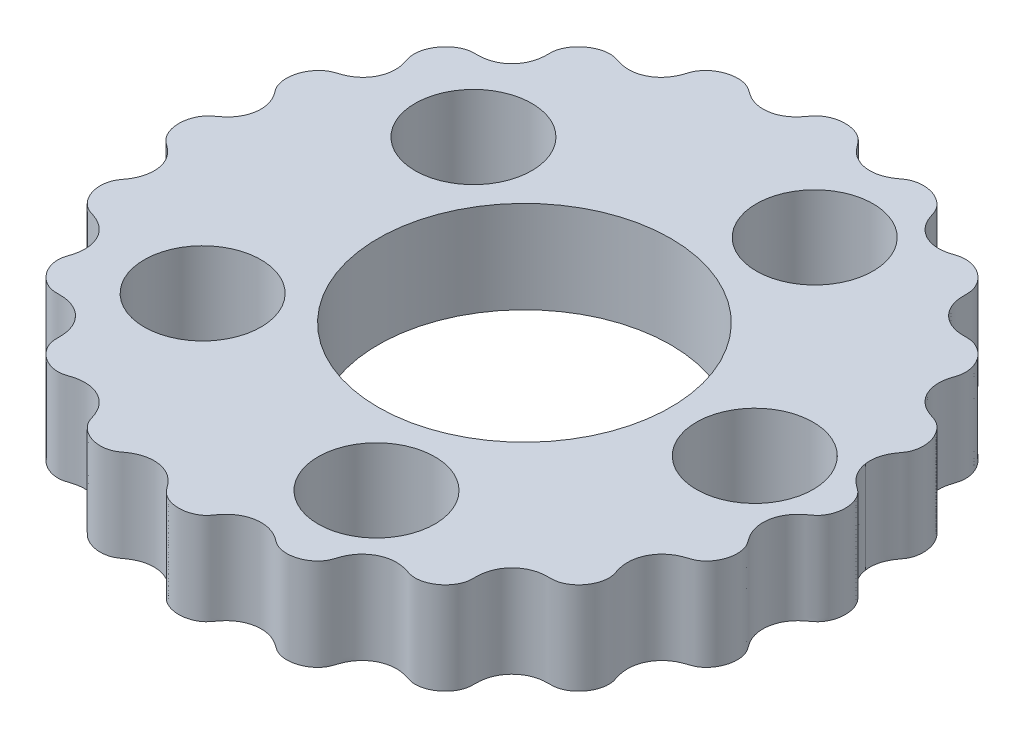
from build123d import *

# Parameters (mm, degrees)
BOSS_EXTRUDE1_START = -1
MAIN_R              = 3.8
MAIN_R_2            = 9.525
BOSS_EXTRUDE1_DEPTH = 6


with BuildPart() as part:
    # MAIN → Boss-Extrude1 (new body)
    with BuildSketch(Plane(origin=(0, 0, 0), x_dir=(1, 0, 0), z_dir=(0, 1, 0)).offset(BOSS_EXTRUDE1_START)):
        with BuildLine():
            add(Edge.make_bspline(
                [(18.252535646, 3.144332747), (18.255931863, 3.122889875), (18.263462541, 3.080075817), (18.279163711, 3.002239377), (18.304264572, 2.900482494), (18.339834412, 2.782038073), (18.390751128, 2.643851255), (18.462636991, 2.484148254), (18.560104298, 2.311641287), (18.672408802, 2.147422449), (18.798228766, 1.993760992), (18.928540075, 1.858883437), (19.059768447, 1.741229888), (19.18873713, 1.638248266), (19.312723639, 1.547238588), (19.437526543, 1.457275247), (19.556609306, 1.35961506), (19.69122381, 1.221787051), (19.85447467, 0.999181145), (20.009441583, 0.673834661), (20.108023531, 0.248073332), (20.109312267, -0.225630706), (20.019147328, -0.635900026), (19.870873584, -0.969925757), (19.689337954, -1.231588239), (19.4944149, -1.421956288), (19.232139459, -1.600600495), (18.947282346, -1.826873991), (18.666926986, -2.129192649), (18.427264596, -2.520635554), (18.271742356, -2.951520203), (18.207615735, -3.403953042), (18.232804752, -3.802125866), (18.310704036, -4.133040174), (18.410591455, -4.397520078), (18.510084776, -4.600453812), (18.631435503, -4.801962603), (18.773031091, -5.000094029), (18.92489094, -5.202962811), (19.039495675, -5.440256941), (19.124128639, -5.738860614), (19.156687742, -6.096281675), (19.113610345, -6.503154294), (18.969385924, -6.93878417), (18.7551245, -7.299557613), (18.523760571, -7.552287386), (18.31489617, -7.712230615), (18.155093135, -7.804449902), (18.020167141, -7.864119464), (17.880713505, -7.911905257), (17.740376268, -7.956724154), (17.532715263, -8.029164247), (17.26395948, -8.146164513), (16.950583676, -8.337718106), (16.625052145, -8.63456365), (16.362055861, -8.991263367), (16.173610007, -9.395412349), (16.068928435, -9.831425328), (16.054349968, -10.225840714), (16.095995363, -10.560219716), (16.163730779, -10.841530538), (16.238233233, -11.071240792), (16.317003389, -11.309867227), (16.348562097, -11.569200033), (16.334127584, -11.876452864), (16.252818366, -12.222925508), (16.082801815, -12.599328222), (15.801555578, -12.975928494), (15.466119616, -13.261772977), (15.139288714, -13.433369321), (14.86359615, -13.514482765), (14.658923302, -13.541247597), (14.494064481, -13.544802883), (14.288163432, -13.543201012), (14.023933266, -13.552909377), (13.703645899, -13.599468125), (13.33829345, -13.713279132), (12.983032231, -13.897034556), (12.664869655, -14.141906152), (12.39479947, -14.44104443), (12.182254841, -14.785197113), (12.034064654, -15.163092392), (11.959620001, -15.531589393), (11.94192056, -15.840622458), (11.945526732, -16.084119035), (11.939080047, -16.298126116), (11.905095877, -16.510234861), (11.810276268, -16.791969612), (11.620030062, -17.12079808), (11.337038761, -17.436072965), (10.957496979, -17.707126628), (10.569148027, -17.872208849), (10.23558904, -17.938959934), (9.974518235, -17.944810716), (9.792533987, -17.925257271), (9.649486971, -17.894297022), (9.509700321, -17.851322129), (9.370923441, -17.805476345), (9.156619674, -17.740791575), (8.86150303, -17.675846371), (8.480819172, -17.648062059), (8.024404129, -17.706199311), (7.592432005, -17.855014485), (7.202560292, -18.086629025), (6.869637911, -18.389375748), (6.637372893, -18.703596471), (6.483412698, -18.999772342), (6.39158475, -19.235955255), (6.33735846, -19.400830623), (6.281624507, -19.572728438), (6.212564228, -19.747873537), (6.100288446, -19.937593234), (5.908822978, -20.168241143), (5.641833206, -20.393207529), (5.289190539, -20.590573871), (4.850509795, -20.724946141), (4.427529312, -20.758735513), (4.079790406, -20.712643032), (3.822609429, -20.628686675), (3.65077244, -20.544644242), (3.521609311, -20.462833571), (3.367480227, -20.350137208), (3.152598709, -20.196380241), (2.858899765, -20.027499983), (2.47164602, -19.882802166), (2.028358751, -19.810724515), (1.584055993, -19.828070491), (1.156158823, -19.931801662), (0.760911539, -20.114778533), (0.454337154, -20.334809347), (0.224179279, -20.560336954), (0.047278491, -20.773736596), (-0.08758477, -20.962405135), (-0.231590296, -21.156579793), (-0.417590931, -21.326011751), (-0.664822067, -21.487756839), (-0.978774511, -21.621341103), (-1.359808069, -21.705013016), (-1.798800674, -21.709764698), (-2.185526583, -21.632945583), (-2.508996457, -21.50148924), (-2.762347714, -21.341299094), (-2.927765633, -21.195558235), (-3.04756269, -21.050327171), (-3.153690808, -20.904064922), (-3.256211446, -20.764016131), (-3.416529897, -20.56776917), (-3.654477933, -20.333665526), (-3.972474745, -20.106597679), (-4.382656563, -19.92154712), (-4.825019462, -19.821745581), (-5.28183576, -19.813700672), (-5.733877675, -19.899448862), (-6.087343705, -20.043511096), (-6.347947146, -20.196473712), (-6.531773445, -20.324216092), (-6.649590989, -20.410702445), (-6.769255924, -20.494770393), (-6.895734755, -20.568419454), (-7.062769094, -20.643251766), (-7.312871469, -20.718363377), (-7.650729742, -20.757953385), (-8.071088583, -20.72095942), (-8.515808623, -20.58045368), (-8.882383705, -20.368063614), (-9.164917646, -20.114110374), (-9.342181105, -19.875478838), (-9.440003359, -19.684228725), (-9.500304626, -19.51632386), (-9.543757526, -19.380469346), (-9.610124748, -19.183456927), (-9.713975801, -18.930330378), (-9.881154258, -18.634138589), (-10.138803675, -18.32049654), (-10.447330051, -18.058887495), (-10.796599078, -17.85783423), (-11.174873852, -17.723273328), (-11.56952079, -17.658287662), (-11.952168331, -17.662951074), (-12.271162516, -17.717642726), (-12.525462925, -17.790062546), (-12.720790276, -17.855212284), (-12.878679428, -17.902775435), (-13.08160551, -17.940567871), (-13.368870225, -17.94861813), (-13.732731025, -17.886416586), (-14.140080414, -17.718217757), (-14.523937348, -17.446959472), (-14.801947543, -17.141517227), (-14.986343133, -16.837128088), (-15.09501752, -16.549373793), (-15.145141647, -16.292981459), (-15.143966403, -16.041692918), (-15.144094729, -15.800202959), (-15.166604346, -15.511729074), (-15.230326015, -15.18084661), (-15.366072019, -14.810240281), (-15.60036553, -14.427915681), (-15.904477092, -14.10178013), (-16.264827695, -13.843808861), (-16.666156897, -13.662086747), (-17.023388314, -13.576746903), (-17.315145323, -13.548523142), (-17.535027894, -13.543799299), (-17.682346334, -13.544540591), (-17.829741274, -13.542187115), (-17.97650235, -13.527132497), (-18.156981567, -13.488808415), (-18.405048234, -13.401236392), (-18.703186868, -13.23237078), (-19.018445652, -12.955466384), (-19.290229869, -12.585723863), (-19.456927008, -12.21207923), (-19.536414446, -11.862086294), (-19.548191069, -11.551950863), (-19.512535733, -11.290842993), (-19.430772576, -11.051003066), (-19.357381178, -10.818763049), (-19.291367957, -10.534622097), (-19.253320343, -10.197080594), (-19.273125667, -9.799720483), (-19.386258205, -9.35826728), (-19.587094605, -8.947753459), (-19.868132291, -8.586041406), (-20.217042266, -8.287801108), (-20.577088054, -8.086923627), (-20.91793115, -7.959744635), (-21.222571233, -7.870894383), (-21.466782335, -7.750076783), (-21.720290425, -7.557319311), (-21.964527197, -7.285460614), (-22.177059063, -6.923134096), (-22.322216185, -6.472216348), (-22.360026542, -6.036829895), (-22.313181921, -5.679519509), (-22.226710093, -5.417361466), (-22.141275309, -5.244681049), (-22.058199519, -5.115002104), (-21.967305108, -4.990875667), (-21.877510473, -4.866006343), (-21.786677013, -4.728211647), (-21.69822844, -4.575764172), (-21.615974275, -4.407220863), (-21.543796818, -4.222196862), (-21.487734431, -4.031316947), (-21.448346495, -3.837125196), (-21.429329621, -3.663026539), (-21.423601733, -3.515902323), (-21.426387904, -3.392176426), (-21.434006471, -3.287351001), (-21.443014616, -3.209178918), (-21.449139429, -3.16577562), (-21.452535646, -3.144332747)],
                knots=[0.062412308, 0.062412308, 0.062412308, 0.062412308, 0.062412308, 0.063559918, 0.064707527, 0.065855137, 0.067002747, 0.069297967, 0.071593186, 0.073888406, 0.076183626, 0.078478845, 0.080774065, 0.082552929, 0.084331793, 0.086110657, 0.087889521, 0.089668385, 0.091447248, 0.095004976, 0.100606257, 0.106207537, 0.111477923, 0.116748309, 0.119877858, 0.123007407, 0.126136956, 0.129266505, 0.134539555, 0.139812605, 0.145085655, 0.150358705, 0.155581176, 0.160803647, 0.163414882, 0.166026118, 0.168637353, 0.171248589, 0.174275412, 0.177302235, 0.180329058, 0.183355881, 0.188576759, 0.193797636, 0.199110481, 0.204423325, 0.20783082, 0.209534567, 0.211238315, 0.212942062, 0.21464581, 0.216349557, 0.218053304, 0.223116106, 0.228178908, 0.233241709, 0.238304511, 0.243485951, 0.24866739, 0.25384883, 0.25643955, 0.25903027, 0.262030578, 0.265030887, 0.268031195, 0.271031503, 0.276209617, 0.28138773, 0.286994806, 0.292601883, 0.296412497, 0.298317804, 0.30022311, 0.302128417, 0.304033724, 0.307844338, 0.312445684, 0.31704703, 0.321648376, 0.326249722, 0.330919307, 0.335588892, 0.340258476, 0.344928061, 0.348226885, 0.349876297, 0.35152571, 0.354824534, 0.358123358, 0.363550726, 0.368978093, 0.374255604, 0.379533116, 0.382913622, 0.384603875, 0.386294128, 0.387984381, 0.389674635, 0.391364888, 0.393055141, 0.398339792, 0.403624443, 0.408909094, 0.414193745, 0.41932566, 0.424457575, 0.42958949, 0.432155447, 0.434721404, 0.436169918, 0.437618431, 0.440515458, 0.443412485, 0.446309512, 0.45143882, 0.456568128, 0.461970068, 0.467372008, 0.470904106, 0.472670155, 0.474436204, 0.476202253, 0.477968302, 0.4815004, 0.48665934, 0.49181828, 0.49697722, 0.50213616, 0.507093068, 0.512049976, 0.517006883, 0.519485337, 0.521963791, 0.524854529, 0.527745267, 0.530636005, 0.533526743, 0.538479307, 0.543431872, 0.54856118, 0.553690488, 0.556587515, 0.559484542, 0.562381569, 0.563830082, 0.565278596, 0.567844553, 0.57041051, 0.575542425, 0.58067434, 0.585806255, 0.591090906, 0.596375557, 0.601660208, 0.606944859, 0.608635112, 0.610325365, 0.612015619, 0.613705872, 0.615396125, 0.617086378, 0.620466884, 0.625744396, 0.631021907, 0.636449274, 0.641876642, 0.645175466, 0.64847429, 0.650123703, 0.651773115, 0.653422527, 0.655071939, 0.659741524, 0.664411108, 0.669080693, 0.673750278, 0.678351624, 0.68295297, 0.687554316, 0.692155662, 0.695966276, 0.697871583, 0.69977689, 0.701682196, 0.703587503, 0.707398117, 0.713005194, 0.71861227, 0.723790383, 0.728968497, 0.731968805, 0.734969113, 0.737969422, 0.74096973, 0.74356045, 0.74615117, 0.75133261, 0.756514049, 0.761695489, 0.766758291, 0.771821092, 0.776883894, 0.781946696, 0.783650443, 0.78535419, 0.787057938, 0.788761685, 0.790465433, 0.79216918, 0.795576675, 0.800889519, 0.806202364, 0.811423241, 0.816644119, 0.819670942, 0.822697765, 0.825724588, 0.828751411, 0.831362647, 0.833973882, 0.839196353, 0.844418824, 0.849641295, 0.854914345, 0.860187395, 0.865460445, 0.870733495, 0.873863044, 0.876992593, 0.880122142, 0.883251691, 0.888522077, 0.893792463, 0.899393743, 0.904995024, 0.908552752, 0.910331615, 0.912110479, 0.913889343, 0.915668207, 0.917447071, 0.919225935, 0.921521155, 0.923816374, 0.926111594, 0.928406814, 0.930702033, 0.932997253, 0.934144863, 0.935292473, 0.936440082, 0.937587692, 0.937587692, 0.937587692, 0.937587692, 0.937587692], degree=4))
            add(Edge.make_bspline(
                [(18.252535646, 3.144332747), (18.250024955, 3.160184626), (18.245408215, 3.19207076), (18.236376921, 3.265514744), (18.226547576, 3.385002505), (18.224854751, 3.510292332), (18.232450992, 3.65777529), (18.250258343, 3.804025823), (18.278099482, 3.948528117), (18.315695332, 4.090898712), (18.38087033, 4.283928818), (18.468982727, 4.478917697), (18.581181172, 4.672463861), (18.714264448, 4.863966707), (18.825727478, 5.013492334), (18.92799239, 5.169848034), (19.009349181, 5.338262614), (19.100560963, 5.602847372), (19.157513287, 5.973286822), (19.128135114, 6.43959584), (18.977148928, 6.904465448), (18.76978179, 7.264476796), (18.561100774, 7.512596474), (18.386399768, 7.672558411), (18.207919443, 7.797780995), (18.031430822, 7.891024938), (17.844127825, 7.958921262), (17.654215011, 8.017918787), (17.42041716, 8.102963176), (17.112626728, 8.248950803), (16.756828739, 8.498403928), (16.399004801, 8.904434401), (16.141332544, 9.442596351), (16.053241957, 9.977898622), (16.088481819, 10.417444757), (16.165194004, 10.736318452), (16.230609264, 10.94378468), (16.285598154, 11.108882213), (16.339191257, 11.320087109), (16.367332749, 11.636504629), (16.313107475, 12.051675784), (16.121561503, 12.537520541), (15.820484818, 12.946249315), (15.491961858, 13.233017641), (15.197130889, 13.404885227), (14.971180196, 13.49730632), (14.758057219, 13.552408856), (14.563235564, 13.576181848), (14.36735847, 13.576733813), (14.171717216, 13.5763106), (13.976136099, 13.587032924), (13.781845407, 13.612010378), (13.502107736, 13.671790537), (13.147440937, 13.80160698), (12.74219066, 14.052750879), (12.351773984, 14.473197927), (12.108753481, 14.94256428), (12.005089168, 15.363446588), (11.977613557, 15.695653153), (11.976116153, 15.930954387), (11.977459824, 16.119249627), (11.95669523, 16.35423033), (11.873478364, 16.666637853), (11.686154157, 17.032824813), (11.355309635, 17.41873152), (10.958883499, 17.698850626), (10.571063378, 17.864846292), (10.242732161, 17.937645584), (10.001279789, 17.957238542), (9.781652832, 17.945553871), (9.587182443, 17.909269546), (9.39905384, 17.849426561), (9.211803633, 17.787720367), (9.021124076, 17.736657376), (8.827213571, 17.699661999), (8.536938276, 17.668979957), (8.149265116, 17.6837946), (7.667185587, 17.806038182), (7.145051178, 18.110896015), (6.770676138, 18.507816334), (6.554143417, 18.890930777), (6.438015366, 19.194422321), (6.373242467, 19.396705169), (6.31927736, 19.557949739), (6.232388768, 19.75227914), (6.064612781, 20.011876324), (5.778349184, 20.300699796), (5.378008854, 20.54787418), (4.913732588, 20.703449926), (4.460542253, 20.75469915), (4.091143087, 20.721684879), (3.811449208, 20.641508527), (3.620445824, 20.552672408), (3.49272641, 20.478060352), (3.378908991, 20.399830914), (3.254775142, 20.307892616), (3.114230786, 20.210540648), (2.931977549, 20.098754803), (2.701868145, 19.984540418), (2.398765088, 19.87893539), (2.019004983, 19.815724876), (1.572507492, 19.825709945), (1.079167542, 19.951219209), (0.650385216, 20.185829959), (0.336641923, 20.467463411), (0.135192732, 20.710133056), (-0.013877131, 20.914461676), (-0.162633588, 21.120245097), (-0.426565939, 21.362328736), (-0.832731385, 21.580530815), (-1.342308031, 21.70911124), (-1.85655301, 21.701226859), (-2.285982325, 21.597686614), (-2.600631729, 21.453300127), (-2.809423483, 21.318430475), (-2.960417316, 21.187531448), (-3.062379421, 21.07629721), (-3.139946369, 20.97751708), (-3.19940905, 20.896533707), (-3.258464422, 20.815275913), (-3.318796658, 20.734965392), (-3.396952543, 20.636674341), (-3.496000189, 20.523019587), (-3.620160848, 20.398290757), (-3.844581126, 20.208825786), (-4.174182301, 20.004375741), (-4.643070132, 19.835884534), (-5.248509419, 19.79668269), (-5.777697181, 19.916581606), (-6.166827622, 20.11001084), (-6.426559184, 20.287263336), (-6.585115615, 20.404234128), (-6.715109118, 20.493602807), (-6.887865299, 20.58910763), (-7.160238053, 20.692981646), (-7.541758494, 20.7576692), (-8.033761563, 20.72817652), (-8.566133449, 20.559063713), (-8.998457356, 20.287207145), (-9.317330405, 19.954169823), (-9.493528072, 19.642376687), (-9.571418556, 19.400695772), (-9.650048466, 19.160303132), (-9.766650574, 18.867259067), (-9.978007639, 18.502457916), (-10.313305766, 18.146828694), (-10.743715095, 17.875011927), (-11.165274093, 17.727540212), (-11.545980402, 17.670304682), (-11.866882386, 17.677077017), (-12.121023557, 17.714593649), (-12.328900445, 17.764588951), (-12.492649467, 17.813745583), (-12.639118276, 17.86282463), (-12.771539298, 17.902053729), (-12.916064072, 17.933546546), (-13.125170959, 17.959011415), (-13.415951493, 17.948833514), (-13.777472958, 17.866081301), (-14.192645684, 17.677296923), (-14.586123126, 17.385866262), (-14.89048828, 17.02707762), (-15.07348984, 16.66392966), (-15.152834253, 16.365192732), (-15.175419305, 16.15352386), (-15.176915399, 15.983496517), (-15.176010273, 15.771094849), (-15.192668523, 15.446578331), (-15.280218127, 15.015290801), (-15.51360953, 14.522126072), (-15.915989951, 14.070816826), (-16.378915481, 13.779001071), (-16.795149082, 13.640237972), (-17.132954067, 13.588987714), (-17.379335655, 13.576123964), (-17.576502449, 13.576904372), (-17.773909525, 13.575704118), (-17.970077059, 13.550109049), (-18.182564185, 13.493357537), (-18.406145129, 13.400108535), (-18.695910104, 13.229413504), (-19.01345371, 12.951698474), (-19.303915645, 12.562787481), (-19.499315857, 12.093531476), (-19.564313707, 11.687380823), (-19.546918453, 11.364548069), (-19.494053703, 11.134651596), (-19.434589379, 10.955987359), (-19.363301409, 10.731739883), (-19.286774797, 10.407302224), (-19.25530563, 9.974985334), (-19.341389684, 9.453493936), (-19.582772724, 8.932979646), (-19.890580908, 8.568898381), (-20.187773592, 8.335837539), (-20.435346841, 8.192539534), (-20.612409812, 8.108745438), (-20.795105128, 8.038110014), (-20.981301797, 7.978056041), (-21.167421417, 7.91700174), (-21.345361564, 7.834189079), (-21.531025939, 7.715924831), (-21.71735813, 7.558204544), (-21.94464904, 7.303640977), (-22.168476655, 6.929388914), (-22.328513461, 6.447626937), (-22.360550219, 5.926370155), (-22.283826577, 5.514762392), (-22.159284037, 5.222527646), (-22.043048065, 5.038221034), (-21.939732579, 4.898196451), (-21.813408379, 4.72109877), (-21.641913366, 4.441537233), (-21.47257104, 4.034393732), (-21.390932668, 3.498069532), (-21.469692358, 2.906621996), (-21.68453283, 2.40989039), (-21.945831571, 2.062698746), (-22.193445009, 1.828743788), (-22.389519817, 1.675614258), (-22.551906398, 1.560817991), (-22.709061016, 1.43836494), (-22.848097706, 1.295146697), (-22.979146676, 1.120899489), (-23.095866249, 0.914781067), (-23.217660493, 0.614319249), (-23.303628735, 0.207848141), (-23.303572522, -0.280926427), (-23.187415414, -0.73349101), (-23.01877845, -1.068200628), (-22.850269704, -1.291649693), (-22.720851829, -1.426680853), (-22.575275552, -1.543782345), (-22.423061945, -1.65154574), (-22.23731461, -1.792550675), (-22.07079846, -1.941953004), (-21.926743776, -2.100169824), (-21.805108982, -2.263612845), (-21.725358466, -2.387396329), (-21.654225995, -2.516224752), (-21.592096648, -2.649812285), (-21.53929544, -2.78774226), (-21.502206964, -2.907307935), (-21.474548847, -3.024506678), (-21.460540277, -3.096530663), (-21.455046337, -3.128480868), (-21.452535646, -3.144332747)],
                knots=[0.063609002, 0.063609002, 0.063609002, 0.063609002, 0.063609002, 0.064458074, 0.065307146, 0.06700529, 0.068703435, 0.070401579, 0.072099723, 0.073797867, 0.075496012, 0.077194156, 0.081499833, 0.083652672, 0.085805511, 0.087958349, 0.090111188, 0.092264027, 0.094416865, 0.100851345, 0.107285824, 0.113598849, 0.116755361, 0.119911874, 0.122207841, 0.124503809, 0.126799776, 0.129095744, 0.131391711, 0.133687679, 0.138279613, 0.144786754, 0.151293894, 0.158381972, 0.16547005, 0.169487075, 0.171495587, 0.1735041, 0.175512612, 0.177521124, 0.181538149, 0.188088893, 0.194639636, 0.201358698, 0.204718229, 0.20807776, 0.210336636, 0.212595511, 0.214854386, 0.217113262, 0.219372137, 0.221631013, 0.223889888, 0.226148764, 0.232563486, 0.238978207, 0.245649795, 0.252321382, 0.256667064, 0.258839905, 0.261012746, 0.263185587, 0.265358428, 0.269704109, 0.275848778, 0.281993447, 0.288591296, 0.291890221, 0.295189145, 0.297465562, 0.29974198, 0.302018397, 0.304294814, 0.306571231, 0.308847648, 0.311124065, 0.313400483, 0.320031256, 0.32666203, 0.333803829, 0.340945629, 0.344868761, 0.346830327, 0.348791893, 0.350753459, 0.352715025, 0.356638156, 0.362992656, 0.369347155, 0.374206536, 0.379065918, 0.383918614, 0.386344962, 0.387558136, 0.38877131, 0.390744311, 0.392717312, 0.394690313, 0.396663314, 0.400609317, 0.404555319, 0.409450074, 0.414344829, 0.421090178, 0.427835527, 0.431732176, 0.433680501, 0.435628826, 0.439525475, 0.443422124, 0.450061542, 0.456700961, 0.46350218, 0.46690279, 0.4703034, 0.472622355, 0.47494131, 0.476100788, 0.477260265, 0.478419743, 0.479579221, 0.480738698, 0.481898176, 0.484217131, 0.486536087, 0.488855042, 0.495440463, 0.502025885, 0.509259804, 0.516493724, 0.520132717, 0.521952213, 0.523771709, 0.525591206, 0.527410702, 0.531049695, 0.537174367, 0.543299039, 0.549938458, 0.556577876, 0.560474525, 0.564371174, 0.566319499, 0.568267824, 0.572164473, 0.578909822, 0.585655171, 0.590549926, 0.595444681, 0.599390683, 0.603336686, 0.605309687, 0.607282688, 0.609255689, 0.61122869, 0.612441864, 0.613655038, 0.616081386, 0.620934082, 0.625793464, 0.630652845, 0.637007344, 0.643361844, 0.647284975, 0.649246541, 0.651208107, 0.653169673, 0.655131239, 0.659054371, 0.666196171, 0.67333797, 0.679968744, 0.686599517, 0.691152352, 0.693428769, 0.695705186, 0.697981603, 0.70025802, 0.702534438, 0.704810855, 0.708109779, 0.711408704, 0.718006553, 0.724151222, 0.730295891, 0.734641572, 0.736814413, 0.738987254, 0.741160095, 0.743332936, 0.747678618, 0.754350205, 0.761021793, 0.767436514, 0.773851236, 0.776110112, 0.778368987, 0.780627863, 0.782886738, 0.785145614, 0.787404489, 0.789663364, 0.79192224, 0.795281771, 0.798641302, 0.805360364, 0.811911107, 0.818461851, 0.822478876, 0.824487388, 0.8264959, 0.828504413, 0.830512925, 0.83452995, 0.841618028, 0.848706106, 0.855213246, 0.861720387, 0.866312321, 0.868608289, 0.870904256, 0.873200224, 0.875496191, 0.877792159, 0.880088126, 0.883244639, 0.886401151, 0.892714176, 0.899148655, 0.905583135, 0.907735973, 0.909888812, 0.912041651, 0.914194489, 0.916347328, 0.918500167, 0.922805844, 0.924503988, 0.926202133, 0.927900277, 0.929598421, 0.931296565, 0.93299471, 0.934692854, 0.935541926, 0.936390998, 0.936390998, 0.936390998, 0.936390998, 0.936390998], degree=4))
        make_face()
        with Locations(Location((14.2, 0.004151236, 0), (0, 0, 270))):
            Circle(MAIN_R, mode=Mode.SUBTRACT)
        with Locations(Location((3.835254916, -14.261696509, 0), (0, 0, 270))):
            Circle(MAIN_R, mode=Mode.SUBTRACT)
        with Locations(Location((-12.935254916, -8.812627549, 0), (0, 0, 270))):
            Circle(MAIN_R, mode=Mode.SUBTRACT)
        with Locations(Location((-12.935254916, 8.82093002, 0), (0, 0, 270))):
            Circle(MAIN_R, mode=Mode.SUBTRACT)
        with Locations(Location((3.835254916, 14.26999898, 0), (0, 0, 270))):
            Circle(MAIN_R, mode=Mode.SUBTRACT)
        with Locations(Location((-0.8, 0.004151236, 0), (0, 0, 270))):
            Circle(MAIN_R_2, mode=Mode.SUBTRACT)
    extrude(amount=-BOSS_EXTRUDE1_DEPTH)


solid = part.part
